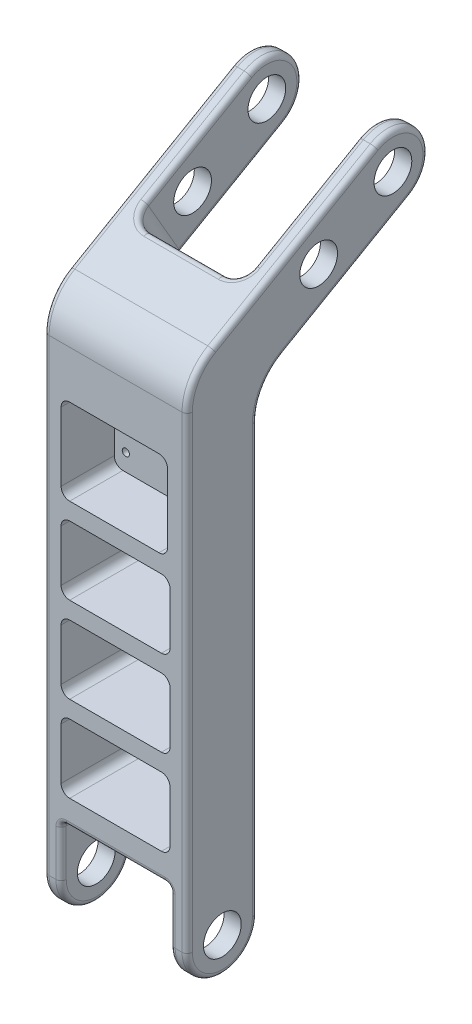
from build123d import *

# Parameters (mm, degrees)
EXTRUDE_1_DEPTH        = 41
EXTRUDE_2_DEPTH        = 10
SKETCH_3_R             = 11
CUT_EXTRUDE_1_DEPTH    = 10
SKETCH_4_W             = 83.5
SKETCH_4_H             = 41
EXTRUDE_3_DEPTH        = 250
CUT_EXTRUDE_2_DEPTH    = 309
EXTRUDE_5_DEPTH        = 83.5
EXTRUDE_6_DEPTH        = 41.75
FILLET_1_R             = 8
SKETCH_10_R            = 5.5
CUT_EXTRUDE_3_DEPTH    = 92
EXTRUDE_9_DEPTH        = 41.75
SKETCH_15_R            = 11
CUT_EXTRUDE_5_DEPTH    = 92.5
SKETCH_16_W            = 63.5
SKETCH_16_H            = 100
CUT_EXTRUDE_6_DEPTH    = 65
FILLET_3_R             = 30
CUT_EXTRUDE_7_DEPTH    = 37.75
SKETCH_19_W            = 70.175183739
SKETCH_19_H            = 45.652615468
CUT_EXTRUDE_8_DEPTH    = 90.5
HOLE_WIZARD_M5_1_D     = 4.2
HOLE_WIZARD_M5_1_DEPTH = 10
HOLE_WIZARD_M5_1_TIP   = 1.2618073
FILLET_5_R             = 10
CUT_EXTRUDE_9_DEPTH    = 31
FILLET_6_R             = 3


with BuildPart() as part:
    # 草图1 → 凸台-拉伸1 (new body)
    with BuildSketch(Plane.XY):
        Polygon((0, 0), (0, 40), (83.5, 40), (83.5, 0), (73.5, 0), (73.5, 30), (10, 30), (10, 0), align=None)
    extrude(amount=EXTRUDE_1_DEPTH)

    # 草图2 → 凸台-拉伸2 (add)
    with BuildSketch(Plane(origin=(83.5, 0, 0), x_dir=(0, 0, -1), z_dir=(1, 0, 0))):
        with BuildLine():
            Line((-41, 0), (0, 0))
            ThreePointArc((0, 0), (-20.5, -20.5), (-41, 0))
        make_face()
    extrude_2 = extrude(amount=-EXTRUDE_2_DEPTH)

    # 草图3 → 切除-拉伸1 (cut)
    with BuildSketch(Plane(origin=(83.5, 0, 0), x_dir=(0, 0, -1), z_dir=(1, 0, 0))):
        with Locations(Location((-20.5, 0, 0), (0, 0, 90))):
            Circle(SKETCH_3_R)
    cut_extrude_1 = extrude(amount=-CUT_EXTRUDE_1_DEPTH, mode=Mode.SUBTRACT)

    # 镜向1: 凸台-拉伸2, 切除-拉伸1 across plane
    add(extrude_2.mirror(Plane(origin=(41.75, 0, 0), x_dir=(0, 0, 1), z_dir=(1, 0, 0))))
    add(cut_extrude_1.mirror(Plane(origin=(41.75, 0, 0), x_dir=(0, 0, 1), z_dir=(1, 0, 0))), mode=Mode.SUBTRACT)

    # 草图4 → 凸台-拉伸3 (add)
    with BuildSketch(Plane(origin=(0, 40, 0), x_dir=(1, 0, 0), z_dir=(0, 1, 0))):
        with Locations((41.75, -20.5)):
            Rectangle(SKETCH_4_W, SKETCH_4_H)
    extrude(amount=EXTRUDE_3_DEPTH)

    # 草图5 → 切除-拉伸2 (cut)
    with BuildSketch(Plane.XY.offset(41)):
        with BuildLine():
            Line((15, 45), (68.5, 45))
            ThreePointArc((68.5, 45), (72.035533906, 46.464466094), (73.5, 50))
            Line((73.5, 50), (73.5, 80))
            ThreePointArc((73.5, 80), (72.035533906, 83.535533906), (68.5, 85))
            Line((68.5, 85), (15, 85))
            ThreePointArc((15, 85), (11.464466094, 83.535533906), (10, 80))
            Line((10, 80), (10, 50))
            ThreePointArc((10, 50), (11.464466094, 46.464466094), (15, 45))
        make_face()
        with BuildLine():
            Line((10, 100), (10, 130))
            ThreePointArc((10, 130), (11.464466094, 133.535533906), (15, 135))
            Line((15, 135), (68.5, 135))
            ThreePointArc((68.5, 135), (72.035533906, 133.535533906), (73.5, 130))
            Line((73.5, 130), (73.5, 100))
            ThreePointArc((73.5, 100), (72.035533906, 96.464466094), (68.5, 95))
            Line((68.5, 95), (15, 95))
            ThreePointArc((15, 95), (11.464466094, 96.464466094), (10, 100))
        make_face()
        with BuildLine():
            Line((10, 150), (10, 180))
            ThreePointArc((10, 180), (11.464466094, 183.535533906), (15, 185))
            Line((15, 185), (68.5, 185))
            ThreePointArc((68.5, 185), (72.035533906, 183.535533906), (73.5, 180))
            Line((73.5, 180), (73.5, 150))
            ThreePointArc((73.5, 150), (72.035533906, 146.464466094), (68.5, 145))
            Line((68.5, 145), (15, 145))
            ThreePointArc((15, 145), (11.464466094, 146.464466094), (10, 150))
        make_face()
    extrude(amount=-CUT_EXTRUDE_2_DEPTH, mode=Mode.SUBTRACT)

    # 草图7 → 凸台-拉伸5 (add)
    with BuildSketch(Plane(origin=(83.5, 0, 0), x_dir=(0, 0, -1), z_dir=(1, 0, 0))):
        Polygon((0, 266.328638963), (89.190706587, 317.82291742), (68.690706587, 353.329958975), (-41, 290), align=None)
    extrude(amount=-EXTRUDE_5_DEPTH)

    # 草图8 → 凸台-拉伸6 (add, symmetric)
    with BuildSketch(Plane(origin=(41.75, 0, 0), x_dir=(0, 0, -1), z_dir=(1, 0, 0))):
        Polygon((0, 236.328638963), (0, 196.328638963), (55, 196.328638963), (55, 214.328638963), align=None)
    extrude(amount=EXTRUDE_6_DEPTH, both=True)

    # 圆角1
    fillet_1_edges = [part.edges().sort_by_distance(p)[0] for p in [
        (41.75, 196.328638963, -55),
    ]]
    fillet(fillet_1_edges, radius=FILLET_1_R)

    # 草图10 → 切除-拉伸3 (cut)
    with BuildSketch(Plane(origin=(83.5, 0, 0), x_dir=(0, 0, -1), z_dir=(1, 0, 0))):
        with Locations(Location((47, 204.328638963, 0), (0, 0, 90))):
            Circle(SKETCH_10_R)
    extrude(amount=-CUT_EXTRUDE_3_DEPTH, mode=Mode.SUBTRACT)

    # 草图14 → 凸台-拉伸9 (add, symmetric)
    with BuildSketch(Plane(origin=(41.75, 0, 0), x_dir=(0, 0, -1), z_dir=(1, 0, 0))):
        with BuildLine():
            Line((68.690706587, 353.329958975), (89.190706587, 317.82291742))
            ThreePointArc((89.190706587, 317.82291742), (96.694227364, 345.826438198), (68.690706587, 353.329958975))
        make_face()
    extrude(amount=EXTRUDE_9_DEPTH, both=True)

    # 草图15 → 切除-拉伸5 (cut, symmetric)
    with BuildSketch(Plane(origin=(83.5, 0, 0), x_dir=(0, 0, -1), z_dir=(1, 0, 0))):
        with Locations((78.940706587, 335.576438198)):
            Circle(SKETCH_15_R)
        with Locations((35.639436397, 310.576438198)):
            Circle(SKETCH_15_R)
    extrude(amount=CUT_EXTRUDE_5_DEPTH, both=True, mode=Mode.SUBTRACT)

    # 草图16 → 切除-拉伸6 (cut)
    with BuildSketch(Plane(origin=(0, 235.253520778, 135.823683549), x_dir=(1, 0, 0), z_dir=(0, 0.8660254037844397, 0.499999999999998))):
        with Locations((41.75, 206.652876396)):
            Rectangle(SKETCH_16_W, SKETCH_16_H)
    extrude(amount=-CUT_EXTRUDE_6_DEPTH, mode=Mode.SUBTRACT)

    # 圆角3
    fillet_3_edges = [part.edges().sort_by_distance(p)[0] for p in [
        (41.75, 266.328638963, 0),
        (41.75, 290, 41),
    ]]
    fillet(fillet_3_edges, radius=FILLET_3_R)

    # 草图8<2> → 切除-拉伸7 (cut, symmetric)
    with BuildSketch(Plane(origin=(41.75, 0, 0), x_dir=(0, 0, -1), z_dir=(1, 0, 0))):
        Polygon((0, 236.328638963), (0, 196.328638963), (55, 196.328638963), (55, 214.328638963), align=None)
    extrude(amount=CUT_EXTRUDE_7_DEPTH, both=True, mode=Mode.SUBTRACT)

    # 草图19 → 切除-拉伸8 (cut)
    with BuildSketch(Plane(origin=(83.5, 0, 0), x_dir=(0, 0, -1), z_dir=(1, 0, 0))):
        with Locations((35.08759187, 213.502331229)):
            Rectangle(SKETCH_19_W, SKETCH_19_H)
    extrude(amount=-CUT_EXTRUDE_8_DEPTH, mode=Mode.SUBTRACT)

    # M5 螺纹孔的螺纹孔钻头1
    with Locations(Plane(origin=(66.75, 225, 0), x_dir=(-1, 0, 0), z_dir=(0, 0, -1))):
        with Locations((0, 0), (50, 0), (50, -20), (0, -20)):
            Hole(HOLE_WIZARD_M5_1_D / 2, depth=HOLE_WIZARD_M5_1_DEPTH)
            with Locations((0, 0, -(HOLE_WIZARD_M5_1_DEPTH + HOLE_WIZARD_M5_1_TIP / 2))):  # 118° drill point
                Cone(0, HOLE_WIZARD_M5_1_D / 2, HOLE_WIZARD_M5_1_TIP, mode=Mode.SUBTRACT)

    # 圆角5
    fillet_5_edges = [part.edges().sort_by_distance(p)[0] for p in [
        (10, 295.826438198, -10.091686986),
        (73.5, 295.826438198, -10.091686986),
    ]]
    fillet(fillet_5_edges, radius=FILLET_5_R)

    # 草图22 → 切除-拉伸9 (cut)
    with BuildSketch(Plane.XY.offset(41)):
        with BuildLine():
            Line((15, 195), (67.035533906, 195))
            ThreePointArc((67.035533906, 195), (70.571067812, 196.464466094), (72.035533906, 200))
            Line((72.035533906, 200), (72.035533906, 240))
            ThreePointArc((72.035533906, 240), (70.571067812, 243.535533906), (67.035533906, 245))
            Line((67.035533906, 245), (15, 245))
            ThreePointArc((15, 245), (11.464466094, 243.535533906), (10, 240))
            Line((10, 240), (10, 200))
            ThreePointArc((10, 200), (11.464466094, 196.464466094), (15, 195))
        make_face()
    extrude(amount=-CUT_EXTRUDE_9_DEPTH, mode=Mode.SUBTRACT)

    # 圆角6
    fillet_6_edges = [part.edges().sort_by_distance(p)[0] for p in [
        (73.5, 15, 0),
        (41.75, 30, 0),
        (10, 15, 0),
        (41.75, 30, 41),
        (73.5, 30, 20.5),
        (10, 30, 20.5),
        (73.5, 15, 41),
        (83.5, 325.995106507, -21.345353293),
        (0, 296.405905211, -52.095353293),
        (0, 124.504065444, 0),
        (0, 345.826438198, -96.694227364),
        (83.5, 345.826438198, -96.694227364),
        (73.5, -20.5, 20.5),
        (10, 335.954958975, -38.596323805),
        (10, 345.826438198, -96.694227364),
        (73.5, 345.826438198, -96.694227364),
        (73.5, 300.44791742, -59.096323805),
        (83.5, 136.339745962, 41),
        (83.5, -20.5, 20.5),
        (83.5, 296.405905211, -52.095353293),
        (0, 325.995106507, -21.345353293),
        (83.5, 287.679491924, 36.980762114),
        (0, 136.339745962, 41),
        (0, 287.679491924, 36.980762114),
        (83.5, 264.008130888, -4.019237886),
        (0, 264.008130888, -4.019237886),
        (0, -20.5, 20.5),
        (41.75, 278.07291742, -20.341686986),
        (41.75, 313.579958975, 0.158313014),
        (10, 300.44791742, -59.096323805),
        (73.5, 335.954958975, -38.596323805),
        (12.928932188, 315.044425069, -2.378216667),
        (12.928932188, 279.537383514, -22.878216667),
        (70.571067812, 315.044425069, -2.378216667),
        (10, -20.5, 20.5),
        (70.571067812, 279.537383514, -22.878216667),
        (10, 15, 41),
        (83.5, 124.504065444, 0),
    ]]
    fillet(fillet_6_edges, radius=FILLET_6_R)


solid = part.part
